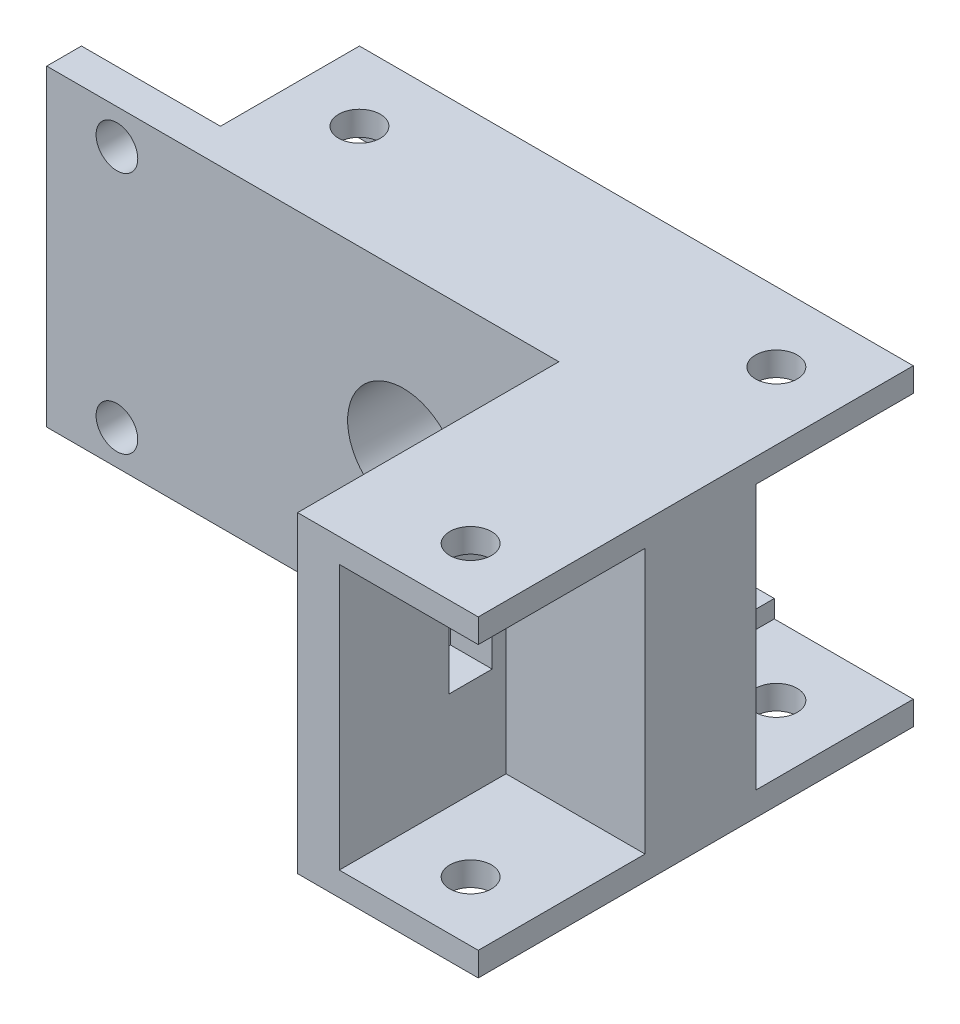
from build123d import *

# Parameters (mm, degrees)
SKETCH1_W               = 36.85
SKETCH1_H               = 22.5
BOSS_EXTRUDE1_DEPTH     = 2.5
SKETCH2_W               = 21.3
SKETCH2_H               = 22.5
BOSS_EXTRUDE2_DEPTH     = 3
SKETCH3_W               = 21.3
SKETCH3_H               = 3
BOSS_EXTRUDE3_DEPTH     = 10
SKETCH4_W               = 49.85
SKETCH4_H               = 3
BOSS_EXTRUDE4_DEPTH     = 10
SKETCH8_W               = 3.1
SKETCH8_H               = 5
CUT_EXTRUDE1_DEPTH      = 5
SKETCH9_R               = 4
SKETCH9_R_2             = 1.5
CUT_EXTRUDE2_DEPTH      = 25
SKETCH11_W              = 10
SKETCH11_H              = 3
CUT_EXTRUDE3_DEPTH      = 10
SKETCH12_R              = 1.5
CUT_EXTRUDE4_DEPTH      = 10
SKETCH14_W              = 12.5
SKETCH14_H              = 10
SKETCH14_W_2            = 10
SKETCH14_H_2            = 8
BOSS_EXTRUDE8_DEPTH     = 19.5
SKETCH13_R              = 1.5
BOSS_EXTRUDE7_DEPTH     = 3
SKETCH15_R              = 4
CUT_EXTRUDE5_DEPTH      = 43
CUT_EXTRUDE6_DEPTH      = 17.7525
CUT_EXTRUDE6_DEPTH_BACK = 1.25
SKETCH16_W              = 10
SKETCH16_H              = 4.5
SKETCH17_W              = 14.131300264
SKETCH17_H              = 19.05
SKETCH17_W_2            = 13.234553728
CUT_EXTRUDE7_DEPTH      = 10


with BuildPart() as part:
    # Sketch1 → Boss-Extrude1 (new body)
    with BuildSketch(Plane.XY):
        with Locations((18.425, 11.25)):
            Rectangle(SKETCH1_W, SKETCH1_H)
    extrude(amount=BOSS_EXTRUDE1_DEPTH)

    # Sketch2 → Boss-Extrude2 (add)
    with BuildSketch(Plane(origin=(36.85, 0, 0), x_dir=(0, 0, -1), z_dir=(1, 0, 0))):
        with Locations((-10.65, 11.25)):
            Rectangle(SKETCH2_W, SKETCH2_H)
    extrude(amount=BOSS_EXTRUDE2_DEPTH)

    # Sketch3 → Boss-Extrude3 (add)
    with BuildSketch(Plane(origin=(39.85, 0, 0), x_dir=(0, 0, -1), z_dir=(1, 0, 0))):
        with Locations((-10.65, 1.5)):
            Rectangle(SKETCH3_W, SKETCH3_H)
    extrude(amount=BOSS_EXTRUDE3_DEPTH)

    # Sketch4 → Boss-Extrude4 (add)
    with BuildSketch(Plane(origin=(0, 0, 0), x_dir=(-1, 0, 0), z_dir=(0, 0, -1))):
        with Locations((-24.925, 1.5)):
            Rectangle(SKETCH4_W, SKETCH4_H)
    extrude(amount=BOSS_EXTRUDE4_DEPTH)

    # Sketch8 → Cut-Extrude1 (cut)
    with BuildSketch(Plane(origin=(39.85, 0, 0), x_dir=(0, 0, -1), z_dir=(1, 0, 0))):
        with Locations((-11.85, 11.25)):
            Rectangle(SKETCH8_W, SKETCH8_H)
    extrude(amount=-CUT_EXTRUDE1_DEPTH, mode=Mode.SUBTRACT)

    # Sketch9 → Cut-Extrude2 (cut)
    with BuildSketch(Plane.XY.offset(2.5)):
        with Locations((25.65, 11.25)):
            Circle(SKETCH9_R)
        with Locations((5.05, 20)):
            Circle(SKETCH9_R_2)
        with Locations((5.05, 2.5)):
            Circle(SKETCH9_R_2)
    extrude(amount=-CUT_EXTRUDE2_DEPTH, mode=Mode.SUBTRACT)

    # Sketch11 → Cut-Extrude3 (cut)
    with BuildSketch(Plane(origin=(0, 0, -10), x_dir=(-1, 0, 0), z_dir=(0, 0, -1))):
        with Locations((-5, 1.5)):
            Rectangle(SKETCH11_W, SKETCH11_H)
    extrude(amount=-CUT_EXTRUDE3_DEPTH, mode=Mode.SUBTRACT)

    # Sketch12 → Cut-Extrude4 (cut)
    with BuildSketch(Plane(origin=(0, 3, 0), x_dir=(1, 0, 0), z_dir=(0, 1, 0))):
        with Locations(Location((15, 5, 0), (0, 0, 270))):
            Circle(SKETCH12_R)
        with Locations(Location((45, 5, 0), (0, 0, 270))):
            Circle(SKETCH12_R)
        with Locations(Location((45, -17, 0), (0, 0, 270))):
            Circle(SKETCH12_R)
    extrude(amount=-CUT_EXTRUDE4_DEPTH, mode=Mode.SUBTRACT)

    # Sketch14 → Boss-Extrude8 (add)
    with BuildSketch(Plane(origin=(0, 3, 0), x_dir=(1, 0, 0), z_dir=(0, 1, 0))):
        with Locations((26.25, 5)):
            Rectangle(SKETCH14_W, SKETCH14_H)
        with Locations((44.85, -5.3)):
            Rectangle(SKETCH14_W_2, SKETCH14_H_2)
    extrude(amount=BOSS_EXTRUDE8_DEPTH)

    # Sketch13 → Boss-Extrude7 (add)
    with BuildSketch(Plane(origin=(0, 22.5, 0), x_dir=(1, 0, 0), z_dir=(0, 1, 0))):
        Polygon((10, 10), (49.85, 10), (49.85, 0), (49.85, -21.3), (39.85, -21.3), (39.85, 0), (10, 0), align=None)
        with Locations(Location((15, 5, 0), (0, 0, 270))):
            Circle(SKETCH13_R, mode=Mode.SUBTRACT)
        with Locations(Location((45, 5, 0), (0, 0, 270))):
            Circle(SKETCH13_R, mode=Mode.SUBTRACT)
        with Locations(Location((45, -17, 0), (0, 0, 270))):
            Circle(SKETCH13_R, mode=Mode.SUBTRACT)
    extrude(amount=-BOSS_EXTRUDE7_DEPTH)

    # Sketch15 → Cut-Extrude5 (cut)
    with BuildSketch(Plane.XY.offset(2.5)):
        with Locations((25.65, 11.25)):
            Circle(SKETCH15_R)
    extrude(amount=-CUT_EXTRUDE5_DEPTH, mode=Mode.SUBTRACT)

    # Sketch16 → Cut-Extrude6 (cut, two sides: drawn at the far end of the back side and taken through both)
    with BuildSketch(Plane.XZ.offset(-19.5).offset(-CUT_EXTRUDE6_DEPTH_BACK)):
        with Locations((15, -5)):
            Rectangle(SKETCH16_W, SKETCH16_H)
    extrude(amount=CUT_EXTRUDE6_DEPTH + CUT_EXTRUDE6_DEPTH_BACK, mode=Mode.SUBTRACT)

    # Sketch17 → Cut-Extrude7 (cut)
    with BuildSketch(Plane(origin=(49.85, 0, 0), x_dir=(0, 0, -1), z_dir=(1, 0, 0))):
        with Locations((-16.365650132, 11.25)):
            Rectangle(SKETCH17_W, SKETCH17_H)
        with Locations((5.317276864, 11.25)):
            Rectangle(SKETCH17_W_2, SKETCH17_H)
    extrude(amount=-CUT_EXTRUDE7_DEPTH, mode=Mode.SUBTRACT)


solid = part.part
